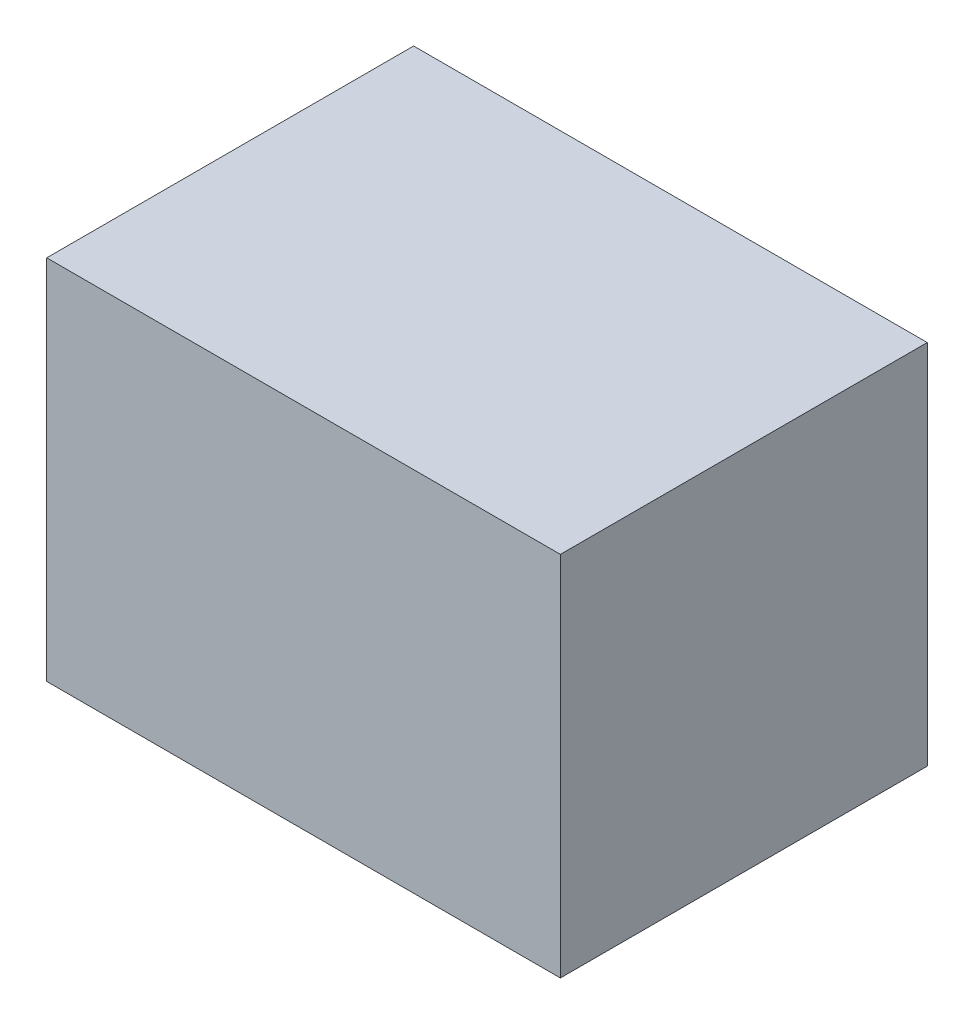
from build123d import *

# Parameters (mm, degrees)
SKETCH1_W           = 38.1
SKETCH1_H           = 38.1
BOSS_EXTRUDE1_DEPTH = 53.34


with BuildPart() as part:
    # Sketch1 → Boss-Extrude1 (new body)
    with BuildSketch(Plane(origin=(0, 0, 0), x_dir=(0, 0, -1), z_dir=(1, 0, 0))):
        with Locations((19.05, 19.05)):
            Rectangle(SKETCH1_W, SKETCH1_H)
    extrude(amount=BOSS_EXTRUDE1_DEPTH)


solid = part.part
